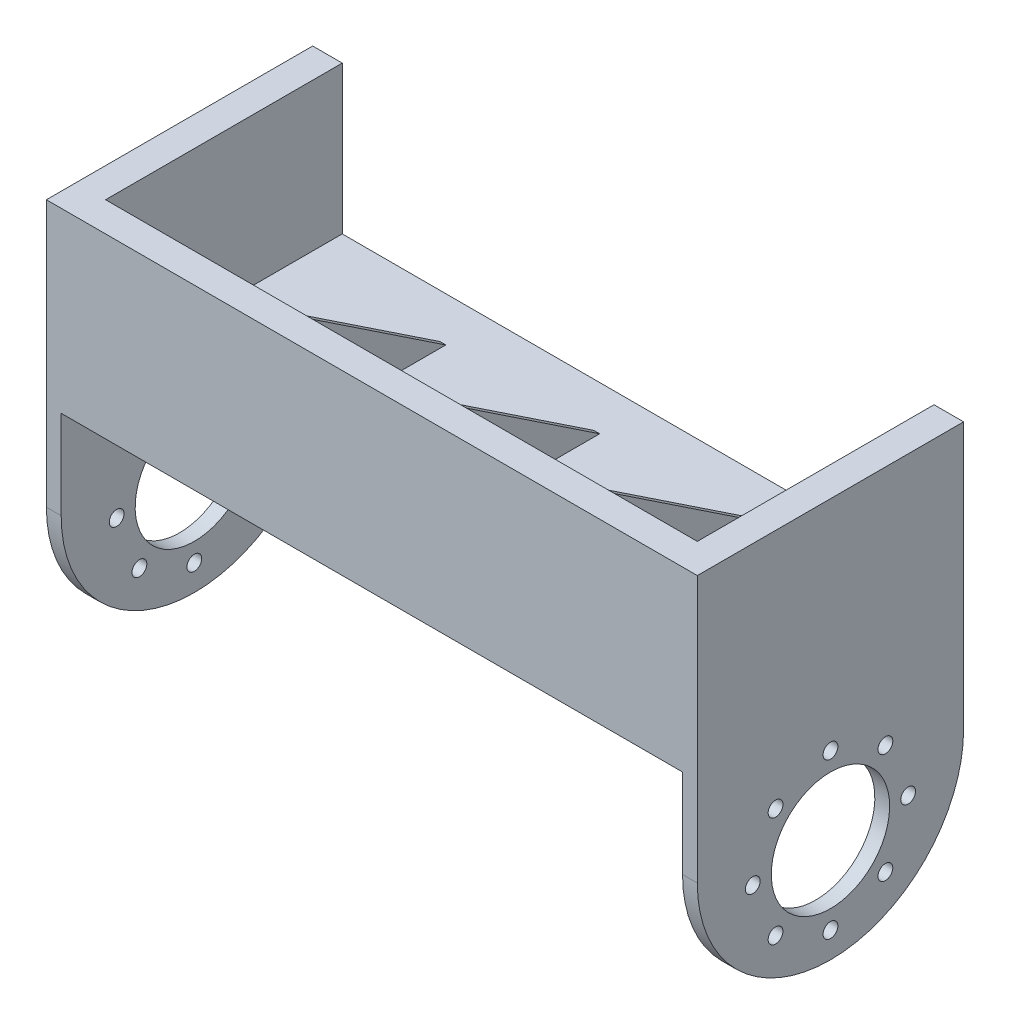
from build123d import *

# Parameters (mm, degrees)
BOSS_EXTRUDE2_DEPTH = 203.2
SKETCH2_W           = 558.8
SKETCH2_H           = 25.4
BOSS_EXTRUDE3_DEPTH = 152.4
BOSS_EXTRUDE4_DEPTH = 5.08
BOSS_EXTRUDE5_DEPTH = 5.08
BOSS_EXTRUDE6_DEPTH = 5.08
BOSS_EXTRUDE7_DEPTH = 558.8
SKETCH7_W           = 533.4
SKETCH7_H           = 190.5
CUT_EXTRUDE1_DEPTH  = 298.590683842
SKETCH8_R           = 50.8
CUT_EXTRUDE2_DEPTH  = 634.092133895
SKETCH10_R          = 6.35
CUT_EXTRUDE3_DEPTH  = 634.092133895


with BuildPart() as part:
    # Sketch1 → Boss-Extrude2 (new body)
    with BuildSketch(Plane.XY):
        Polygon((-279.4, 0), (279.4, 0), (279.4, 152.4), (254, 152.4), (254, 25.4), (-254, 25.4), (-254, 152.4), (-279.4, 152.4), align=None)
    extrude(amount=BOSS_EXTRUDE2_DEPTH)

    # Sketch2 → Boss-Extrude3 (add)
    with BuildSketch(Plane(origin=(0, 0, 0), x_dir=(1, 0, 0), z_dir=(0, 1, 0))):
        with Locations((0, -215.9)):
            Rectangle(SKETCH2_W, SKETCH2_H)
    extrude(amount=BOSS_EXTRUDE3_DEPTH)

    # Sketch3 → Boss-Extrude4 (add)
    with BuildSketch(Plane(origin=(127, 0, 0), x_dir=(0, 0, -1), z_dir=(1, 0, 0))):
        Polygon((-228.6, 152.4), (0, 0), (-228.6, 0), align=None)
    extrude(amount=BOSS_EXTRUDE4_DEPTH)

    # Sketch4 → Boss-Extrude5 (add)
    with BuildSketch(Plane(origin=(0, 0, 0), x_dir=(0, 0, -1), z_dir=(1, 0, 0))):
        Polygon((-228.6, 152.4), (0, 0), (-228.6, 0), align=None)
    extrude(amount=BOSS_EXTRUDE5_DEPTH)

    # Sketch5 → Boss-Extrude6 (add)
    with BuildSketch(Plane(origin=(-127, 0, 0), x_dir=(0, 0, -1), z_dir=(1, 0, 0))):
        Polygon((-228.6, 152.4), (0, 0), (-228.6, 0), align=None)
    extrude(amount=-BOSS_EXTRUDE6_DEPTH)

    # Sketch6 → Boss-Extrude7 (add)
    with BuildSketch(Plane(origin=(279.4, 0, 0), x_dir=(0, 0, -1), z_dir=(1, 0, 0))):
        with BuildLine():
            Line((0, 0), (-228.6, 0))
            Line((-228.6, 0), (-228.6, -76.2))
            ThreePointArc((-228.6, -76.2), (-114.3, -190.5), (0, -76.2))
            Line((0, -76.2), (0, 0))
        make_face()
    extrude(amount=-BOSS_EXTRUDE7_DEPTH)

    # Sketch7 → Cut-Extrude1 (cut)
    with BuildSketch(Plane.XY):
        with Locations((0, -95.25)):
            Rectangle(SKETCH7_W, SKETCH7_H)
    extrude(amount=CUT_EXTRUDE1_DEPTH, mode=Mode.SUBTRACT)

    # Sketch8 → Cut-Extrude2 (cut, through all)
    with BuildSketch(Plane(origin=(279.4, 0, 0), x_dir=(0, 0, -1), z_dir=(1, 0, 0))):
        with Locations((-114.3, -101.6)):
            Circle(SKETCH8_R)
    extrude(amount=-CUT_EXTRUDE2_DEPTH, mode=Mode.SUBTRACT)

    # Sketch10 → Cut-Extrude3 (cut, through all)
    with BuildSketch(Plane(origin=(279.4, 0, 0), x_dir=(0, 0, -1), z_dir=(1, 0, 0))):
        with Locations((-114.3, -34.925)):
            Circle(SKETCH10_R)
        with Locations((-67.153655364, -54.453655364)):
            Circle(SKETCH10_R)
        with Locations((-47.625, -101.6)):
            Circle(SKETCH10_R)
        with Locations((-67.153655364, -148.746344636)):
            Circle(SKETCH10_R)
        with Locations((-114.3, -168.275)):
            Circle(SKETCH10_R)
        with Locations((-161.446344636, -148.746344636)):
            Circle(SKETCH10_R)
        with Locations((-180.975, -101.6)):
            Circle(SKETCH10_R)
        with Locations((-161.446344636, -54.453655364)):
            Circle(SKETCH10_R)
    extrude(amount=-CUT_EXTRUDE3_DEPTH, mode=Mode.SUBTRACT)


solid = part.part
